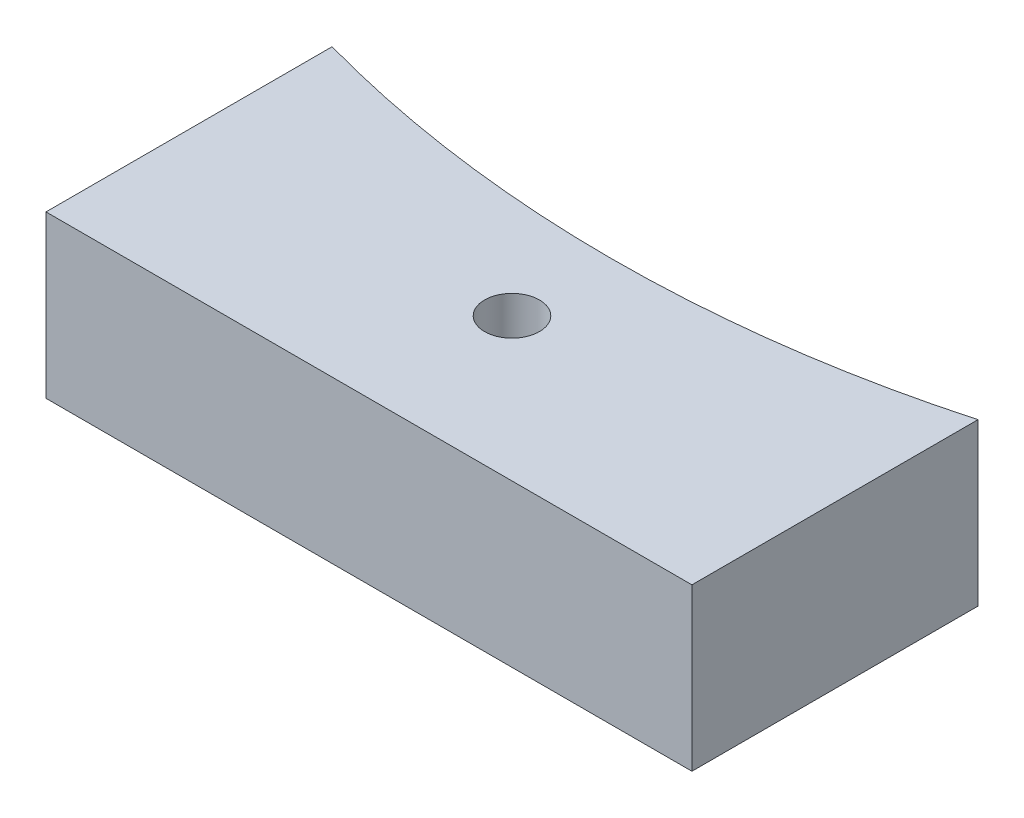
from build123d import *

# Parameters (mm, degrees)
IZIM1_W                          = 150
IZIM1_H                          = 70
Y_KSEKLIK_EKSTR_ZYON1_REACH      = 371.188
Y_KSEKLIK_EKSTR_ZYON1_END_RADIUS = 150
IZIM2_W                          = 79.999999942
IZIM2_H                          = 40
DELIK1_D                         = 260
F_6_8_6_8_AP_DELIK1_D            = 6.8
F_6_8_6_8_AP_DELIK1_DEPTH        = 40
IZIM10_R                         = 150
IZIM10_R_2                       = 130
KES_EKSTR_ZYON2_DEPTH            = 70
KES_EKSTR_ZYON3_START            = -20
KES_EKSTR_ZYON3_DEPTH            = 20


with BuildPart() as part:
    # Çizim1 → Döndür1 (revolve)
    with BuildSketch(Plane.XY, mode=Mode.PRIVATE) as d_nd_r1_sk:
        with Locations((75, 35)):
            Rectangle(IZIM1_W, IZIM1_H)
    revolve(d_nd_r1_sk.sketch.rotate(Axis((0, 70, 0), (0, -1, 0)), 270), axis=Axis((0, 70, 0), (0, -1, 0)))

    # Yükseklik-Ekstrüzyon1: up to this cylinder (the profile starts outside it)
    y_kseklik_ekstr_zyon1_end = Plane(origin=(0, 20, 0), z_dir=(0, -1, 0)) * Cylinder(Y_KSEKLIK_EKSTR_ZYON1_END_RADIUS, 1043.376, mode=Mode.PRIVATE)
    # Çizim2 → Yükseklik-Ekstrüzyon1 (add, up to the surface)
    with BuildSketch(Plane.XY.offset(180), mode=Mode.PRIVATE) as y_kseklik_ekstr_zyon1_sk1:
        with Locations((1e-08, 20)):
            Rectangle(IZIM2_W, IZIM2_H)
    y_kseklik_ekstr_zyon1_tool1 = extrude(y_kseklik_ekstr_zyon1_sk1.sketch, amount=-Y_KSEKLIK_EKSTR_ZYON1_REACH, mode=Mode.PRIVATE) - y_kseklik_ekstr_zyon1_end
    add(y_kseklik_ekstr_zyon1_tool1.solids().sort_by_distance((0, 20, 180))[0])

    # Delik1 (through all)
    with Locations(Plane(origin=(0, 70, 0), x_dir=(1, 0, 0), z_dir=(0, 1, 0))):
        with Locations((0, 0)):
            Hole(DELIK1_D / 2)

    # Ø6.8 (6.8) Çap Delik1
    with Locations(Plane(origin=(0, 40, 0), x_dir=(1, 0, 0), z_dir=(0, 1, 0))):
        with Locations((0, -162.284161474), (0, 162.284161474)):
            Hole(F_6_8_6_8_AP_DELIK1_D / 2, depth=F_6_8_6_8_AP_DELIK1_DEPTH)

    # Çizim10 → Kes-Ekstrüzyon2 (cut)
    with BuildSketch(Plane(origin=(0, 70, 0), x_dir=(1, 0, 0), z_dir=(0, 1, 0))):
        Circle(IZIM10_R)
        Circle(IZIM10_R_2, mode=Mode.SUBTRACT)
    extrude(amount=-KES_EKSTR_ZYON2_DEPTH, mode=Mode.SUBTRACT)

    # Çizim11 → Kes-Ekstrüzyon3 (cut)
    with BuildSketch(Plane.XZ.offset(KES_EKSTR_ZYON3_START)):
        with BuildLine():
            Line((39.999999981, 144.568322953), (39.999999981, 180))
            Line((39.999999981, 180), (-39.999999961, 180))
            Line((-39.999999961, 180), (-39.999999961, 144.568322959))
            ThreePointArc((-39.999999961, 144.568322959), (1e-08, 150), (39.999999981, 144.568322953))
        make_face()
    extrude(amount=KES_EKSTR_ZYON3_DEPTH, mode=Mode.SUBTRACT)


solid = part.part
